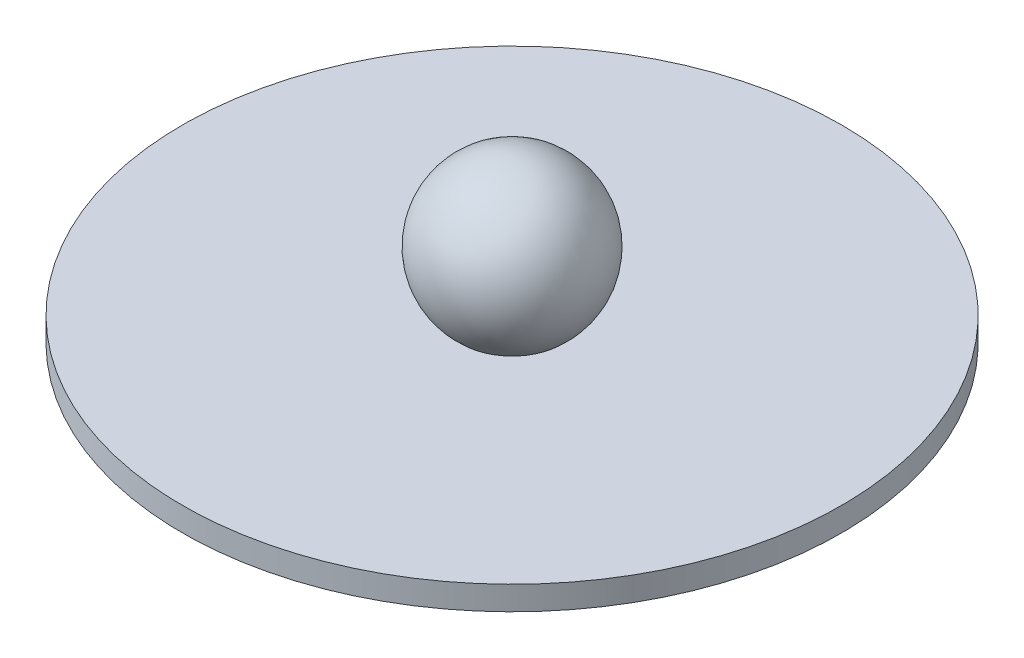
from build123d import *


with BuildPart() as part:
    # Sketch1 → Revolve1 (revolve)
    with BuildSketch(Plane.XY, mode=Mode.PRIVATE) as revolve1_sk:
        Polygon((80.645, 12.7), (80.645, 6.858), (75.565, 6.858), (68.707, 0), (0, 0), (0, 12.7), align=None)
    revolve(revolve1_sk.sketch.rotate(Axis((0, 0, 0), (0, 1, 0)), 90), axis=Axis((0, 0, 0), (0, 1, 0)))

    # Sketch2 → Revolve2 (revolve)
    with BuildSketch(Plane.XY):
        with BuildLine():
            Line((0, 46.314295443), (0, 8.214295443))
            ThreePointArc((0, 8.214295443), (19.05, 27.264295443), (0, 46.314295443))
        make_face()
    revolve(axis=Axis((0, 0, 0), (0, 1, 0)))


solid = part.part
